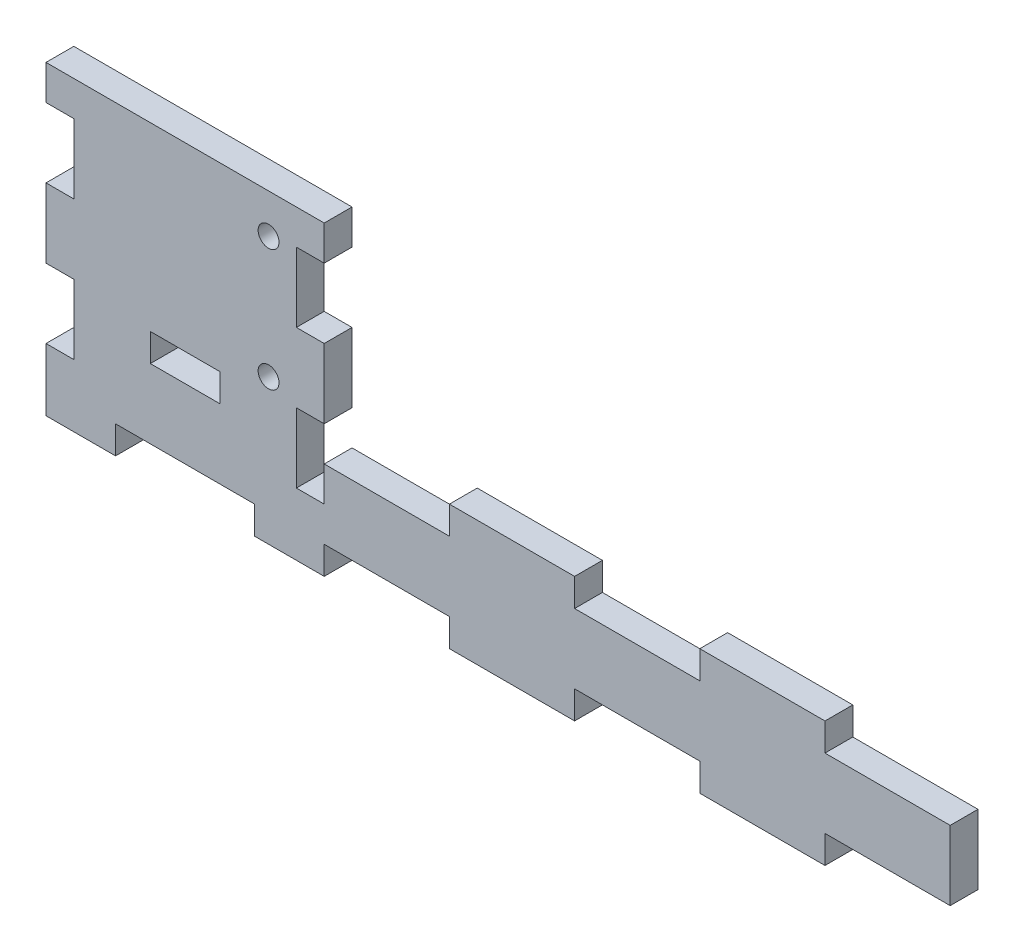
from build123d import *

# Parameters (mm, degrees)
SKETCH1_W           = 40
SKETCH1_H           = 40
BOSS_EXTRUDE1_DEPTH = 2
SKETCH2_R           = 1.5
CUT_EXTRUDE1_DEPTH  = 29.565713714
SKETCH3_W           = 4
SKETCH3_H           = 10
SKETCH3_W_2         = 10
SKETCH3_H_2         = 4
CUT_EXTRUDE2_DEPTH  = 29.565713714
SKETCH4_W           = 10
SKETCH4_H           = 4
BOSS_EXTRUDE2_DEPTH = 4
BOSS_EXTRUDE3_DEPTH = 4


with BuildPart() as part:
    # Sketch1 → Boss-Extrude1 (new, symmetric)
    with BuildSketch(Plane.XY):
        Rectangle(SKETCH1_W, SKETCH1_H)
    extrude(amount=BOSS_EXTRUDE1_DEPTH, both=True)

    # Sketch2 → Cut-Extrude1 (cut, through all)
    with BuildSketch(Plane.XY.offset(2)):
        with Locations((12, 14.35)):
            Circle(SKETCH2_R)
        with Locations((12, -3.15)):
            Circle(SKETCH2_R)
    extrude(amount=-CUT_EXTRUDE1_DEPTH, mode=Mode.SUBTRACT)

    # Sketch3 → Cut-Extrude2 (cut, through all)
    with BuildSketch(Plane.XY.offset(2)):
        with Locations((18, 10)):
            Rectangle(SKETCH3_W, SKETCH3_H)
        with Locations((-18, 10)):
            Rectangle(SKETCH3_W, SKETCH3_H)
        with Locations((-18, -10)):
            Rectangle(SKETCH3_W, SKETCH3_H)
        with Locations((18, -10)):
            Rectangle(SKETCH3_W, SKETCH3_H)
        with Locations((0, -8)):
            Rectangle(SKETCH3_W_2, SKETCH3_H_2)
    extrude(amount=-CUT_EXTRUDE2_DEPTH, mode=Mode.SUBTRACT)

    # Sketch4 → Boss-Extrude2 (add)
    with BuildSketch(Plane.XY.offset(2)):
        with Locations((-15, -22)):
            Rectangle(SKETCH4_W, SKETCH4_H)
        with Locations((15, -22)):
            Rectangle(SKETCH4_W, SKETCH4_H)
    extrude(amount=-BOSS_EXTRUDE2_DEPTH)

    # Sketch5 → Boss-Extrude3 (add)
    with BuildSketch(Plane.XY.offset(2)):
        Polygon((20, -20), (38, -20), (38, -24), (56, -24), (56, -20), (74, -20), (74, -24), (92, -24), (92, -20), (110, -20), (110, -10), (92, -10), (92, -6), (74, -6), (74, -10), (56, -10), (56, -6), (38, -6), (38, -10), (20, -10), align=None)
    extrude(amount=-BOSS_EXTRUDE3_DEPTH)


solid = part.part
